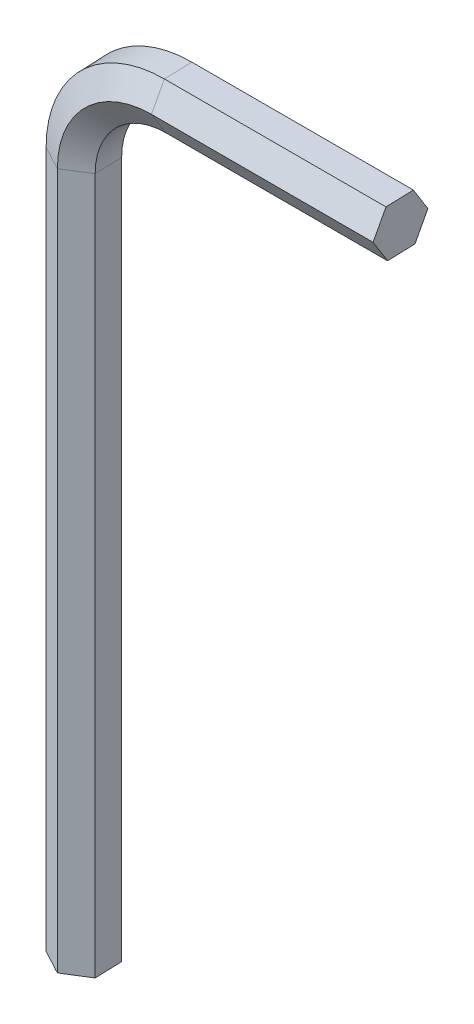
from build123d import *


with BuildPart() as part:
    # Sweep1: sweep along a path in Sketch1
    with BuildLine(Plane.XY) as sweep1_path:
        Line((0, 0), (0, 55.88))
        ThreePointArc((0, 55.88), (2.231846327, 61.268153673), (7.62, 63.5))
        Line((7.62, 63.5), (25.4, 63.5))
    # Sketch2 → Sweep1 (sweep)
    with BuildSketch(Plane(origin=(0, 0, 0), x_dir=(1, 0, 0), z_dir=(0, 1, 0))):
        Polygon((1.86768078, 1.162096599), (-0.072564786, 2.198507301), (-1.940245566, 1.036410702), (-1.86768078, -1.162096599), (0.072564786, -2.198507301), (1.940245566, -1.036410702), align=None)
    sweep(path=sweep1_path.line)


solid = part.part
